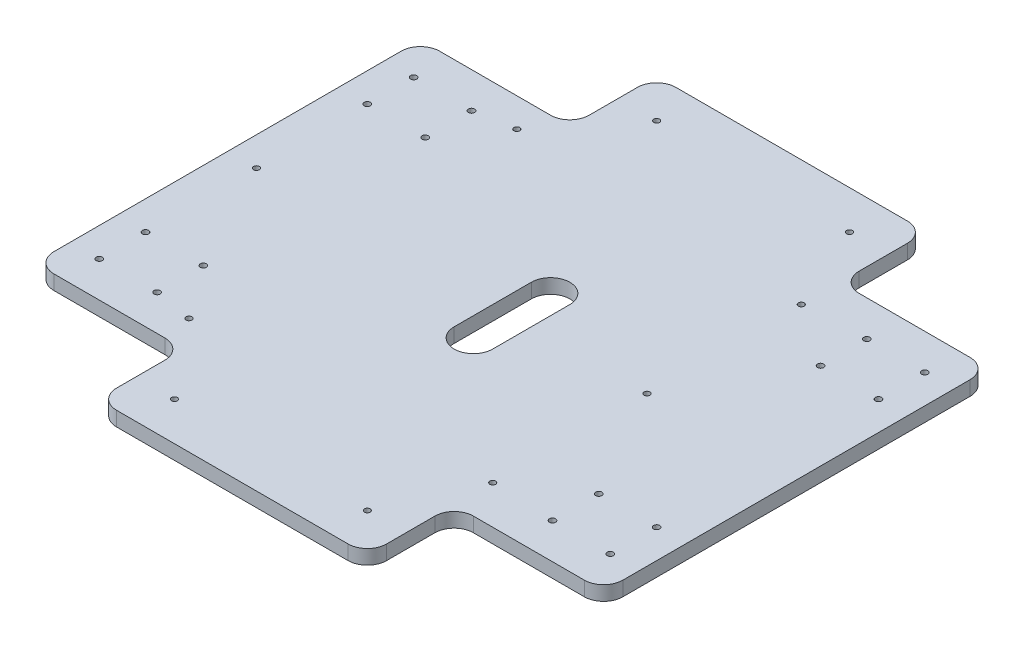
from build123d import *

# Parameters (mm, degrees)
SKETCH_1_W           = 300
SKETCH_1_H           = 300
EXTRUDE_1_DEPTH      = 7.5
SKETCH_2_W           = 80
SKETCH_2_H           = 50
CUT_EXTRUDE_1_DEPTH  = 50
SKETCH_3_R           = 1.6
SKETCH_3_R_2         = 1.600000001
SKETCH_3_R_3         = 1.599999999
CUT_EXTRUDE_2_DEPTH  = 500
CUT_EXTRUDE_4_DEPTH  = 0.01
SKETCH_6_W           = 140
SKETCH_6_H           = 5
CUT_EXTRUDE_5_DEPTH  = 400
SKETCH_7_W           = 140
SKETCH_7_H           = 5
CUT_EXTRUDE_6_DEPTH  = 500
SKETCH_8_W           = 2.5
SKETCH_8_H           = 200
CUT_EXTRUDE_7_DEPTH  = 500
SKETCH_9_W           = 2.5
SKETCH_9_H           = 200
CUT_EXTRUDE_8_DEPTH  = 500
FILLET_1_R           = 10
FILLET_2_R           = 10
FILLET_3_R           = 10
FILLET_4_R           = 10
FILLET_5_R           = 10
FILLET_6_R           = 10
SKETCH_11_R          = 1.5
CUT_EXTRUDE_9_DEPTH  = 500
SKETCH_12_R          = 1.5
CUT_EXTRUDE_10_DEPTH = 500
CUT_EXTRUDE_11_DEPTH = 50


with BuildPart() as part:
    # 草图1 → 凸台-拉伸1 (new body)
    with BuildSketch(Plane(origin=(0, 0, 0), x_dir=(1, 0, 0), z_dir=(0, 1, 0))):
        Rectangle(SKETCH_1_W, SKETCH_1_H)
    extrude(amount=EXTRUDE_1_DEPTH)

    # 草图2 → 切除-拉伸1 (cut)
    with BuildSketch(Plane(origin=(0, 0, 0), x_dir=(-1, 0, 0), z_dir=(0, -1, 0))):
        with Locations((-110, -125)):
            Rectangle(SKETCH_2_W, SKETCH_2_H)
        with Locations((-110, 125)):
            Rectangle(SKETCH_2_W, SKETCH_2_H)
        with Locations((110, -125)):
            Rectangle(SKETCH_2_W, SKETCH_2_H)
        with Locations((110, 125)):
            Rectangle(SKETCH_2_W, SKETCH_2_H)
    extrude(amount=-CUT_EXTRUDE_1_DEPTH, mode=Mode.SUBTRACT)

    # 草图3 → 切除-拉伸2 (cut)
    with BuildSketch(Plane.XZ):
        with Locations(Location((132.5, 81.505719169, 0), (0, 0, 270))):
            Circle(SKETCH_3_R)
        with Locations(Location((132.5, 57.505719169, 0), (0, 0, 270))):
            Circle(SKETCH_3_R)
        with Locations(Location((102.5, 81.505719169, 0), (0, 0, 270))):
            Circle(SKETCH_3_R)
        with Locations(Location((102.5, 57.505719169, 0), (0, 0, 270))):
            Circle(SKETCH_3_R)
        with Locations(Location((-102.5, 81.505719169, 0), (0, 0, 270))):
            Circle(SKETCH_3_R_2)
        with Locations(Location((-102.5, 57.505719169, 0), (0, 0, 270))):
            Circle(SKETCH_3_R_2)
        with Locations(Location((-132.5, 81.505719169, 0), (0, 0, 270))):
            Circle(SKETCH_3_R_2)
        with Locations(Location((-132.5, 57.505719169, 0), (0, 0, 270))):
            Circle(SKETCH_3_R_2)
        with Locations(Location((-132.5, -57.505719169, 0), (0, 0, 270))):
            Circle(SKETCH_3_R_3)
        with Locations(Location((-132.5, -81.505719169, 0), (0, 0, 270))):
            Circle(SKETCH_3_R_3)
        with Locations(Location((-102.5, -57.505719169, 0), (0, 0, 270))):
            Circle(SKETCH_3_R_3)
        with Locations(Location((-102.5, -81.505719169, 0), (0, 0, 270))):
            Circle(SKETCH_3_R_3)
        with Locations(Location((132.5, -81.505719169, 0), (0, 0, 270))):
            Circle(SKETCH_3_R)
        with Locations(Location((132.5, -57.505719169, 0), (0, 0, 270))):
            Circle(SKETCH_3_R)
        with Locations(Location((102.5, -57.505719169, 0), (0, 0, 270))):
            Circle(SKETCH_3_R)
        with Locations(Location((102.5, -81.505719169, 0), (0, 0, 270))):
            Circle(SKETCH_3_R)
    extrude(amount=-CUT_EXTRUDE_2_DEPTH, mode=Mode.SUBTRACT)

    # 草图5 → 切除-拉伸4 (cut)
    with BuildSketch(Plane.XZ):
        Polygon((145.77960396, 0), (141.689907669, 4.08969629), (141.689907669, -4.08969629), align=None)
    extrude(amount=-CUT_EXTRUDE_4_DEPTH, mode=Mode.SUBTRACT)

    # 草图6 → 切除-拉伸5 (cut)
    with BuildSketch(Plane(origin=(0, 7.5, 0), x_dir=(1, 0, 0), z_dir=(0, 1, 0))):
        with Locations((0, 147.5)):
            Rectangle(SKETCH_6_W, SKETCH_6_H)
    extrude(amount=-CUT_EXTRUDE_5_DEPTH, mode=Mode.SUBTRACT)

    # 草图7 → 切除-拉伸6 (cut)
    with BuildSketch(Plane(origin=(0, 7.5, 0), x_dir=(1, 0, 0), z_dir=(0, 1, 0))):
        with Locations((0, -147.5)):
            Rectangle(SKETCH_7_W, SKETCH_7_H)
    extrude(amount=-CUT_EXTRUDE_6_DEPTH, mode=Mode.SUBTRACT)

    # 草图8 → 切除-拉伸7 (cut)
    with BuildSketch(Plane(origin=(0, 7.5, 0), x_dir=(1, 0, 0), z_dir=(0, 1, 0))):
        with Locations((-148.75, 0)):
            Rectangle(SKETCH_8_W, SKETCH_8_H)
    extrude(amount=-CUT_EXTRUDE_7_DEPTH, mode=Mode.SUBTRACT)

    # 草图9 → 切除-拉伸8 (cut)
    with BuildSketch(Plane(origin=(0, 7.5, 0), x_dir=(1, 0, 0), z_dir=(0, 1, 0))):
        with Locations((148.75, 0)):
            Rectangle(SKETCH_9_W, SKETCH_9_H)
    extrude(amount=-CUT_EXTRUDE_8_DEPTH, mode=Mode.SUBTRACT)

    # 圆角1
    fillet_1_edges = [part.edges().sort_by_distance(p)[0] for p in [
        (-70, 3.75, 145),
        (70, 3.75, 145),
    ]]
    fillet(fillet_1_edges, radius=FILLET_1_R)

    # 圆角2
    fillet_2_edges = [part.edges().sort_by_distance(p)[0] for p in [
        (-70, 3.75, 100),
        (70, 3.75, 100),
    ]]
    fillet(fillet_2_edges, radius=FILLET_2_R)

    # 圆角3
    fillet_3_edges = [part.edges().sort_by_distance(p)[0] for p in [
        (-147.5, 3.75, 100),
        (147.5, 3.75, 100),
    ]]
    fillet(fillet_3_edges, radius=FILLET_3_R)

    # 圆角4
    fillet_4_edges = [part.edges().sort_by_distance(p)[0] for p in [
        (-147.5, 3.75, -100),
        (147.5, 3.75, -100),
    ]]
    fillet(fillet_4_edges, radius=FILLET_4_R)

    # 圆角5
    fillet_5_edges = [part.edges().sort_by_distance(p)[0] for p in [
        (70, 3.75, -100),
        (-70, 3.75, -100),
    ]]
    fillet(fillet_5_edges, radius=FILLET_5_R)

    # 圆角6
    fillet_6_edges = [part.edges().sort_by_distance(p)[0] for p in [
        (70, 3.75, -145),
        (-70, 3.75, -145),
    ]]
    fillet(fillet_6_edges, radius=FILLET_6_R)

    # 草图11 → 切除-拉伸9 (cut)
    with BuildSketch(Plane.XZ):
        with Locations(Location((-50, 125, 0), (0, 0, 270))):
            Circle(SKETCH_11_R)
    extrude(amount=-CUT_EXTRUDE_9_DEPTH, mode=Mode.SUBTRACT)

    # 草图12 → 切除-拉伸10 (cut)
    with BuildSketch(Plane.XZ):
        with Locations(Location((50, 125, 0), (0, 0, 270))):
            Circle(SKETCH_12_R)
        with Locations(Location((70, 80, 0), (0, 0, 270))):
            Circle(SKETCH_12_R)
        with Locations(Location((70, 0, 0), (0, 0, 270))):
            Circle(SKETCH_12_R)
        with Locations(Location((70, -80, 0), (0, 0, 270))):
            Circle(SKETCH_12_R)
        with Locations(Location((50, -125, 0), (0, 0, 270))):
            Circle(SKETCH_12_R)
        with Locations(Location((-50, -125, 0), (0, 0, 270))):
            Circle(SKETCH_12_R)
        with Locations(Location((-82.5, -85, 0), (0, 0, 270))):
            Circle(SKETCH_12_R)
        with Locations(Location((-132.5, 0, 0), (0, 0, 270))):
            Circle(SKETCH_12_R)
        with Locations(Location((-50, 125, 0), (0, 0, 270))):
            Circle(SKETCH_12_R)
        with Locations(Location((-82.5, 85, 0), (0, 0, 270))):
            Circle(SKETCH_12_R)
    extrude(amount=-CUT_EXTRUDE_10_DEPTH, mode=Mode.SUBTRACT)

    # 草图13 → 切除-拉伸11 (cut)
    with BuildSketch(Plane(origin=(0, 7.5, 0), x_dir=(1, 0, 0), z_dir=(0, 1, 0))):
        with BuildLine():
            Line((-10, -20), (-10, 20))
            ThreePointArc((-10, 20), (0, 30), (10, 20))
            Line((10, 20), (10, -20))
            ThreePointArc((10, -20), (0, -30), (-10, -20))
        make_face()
    extrude(amount=-CUT_EXTRUDE_11_DEPTH, mode=Mode.SUBTRACT)


solid = part.part
